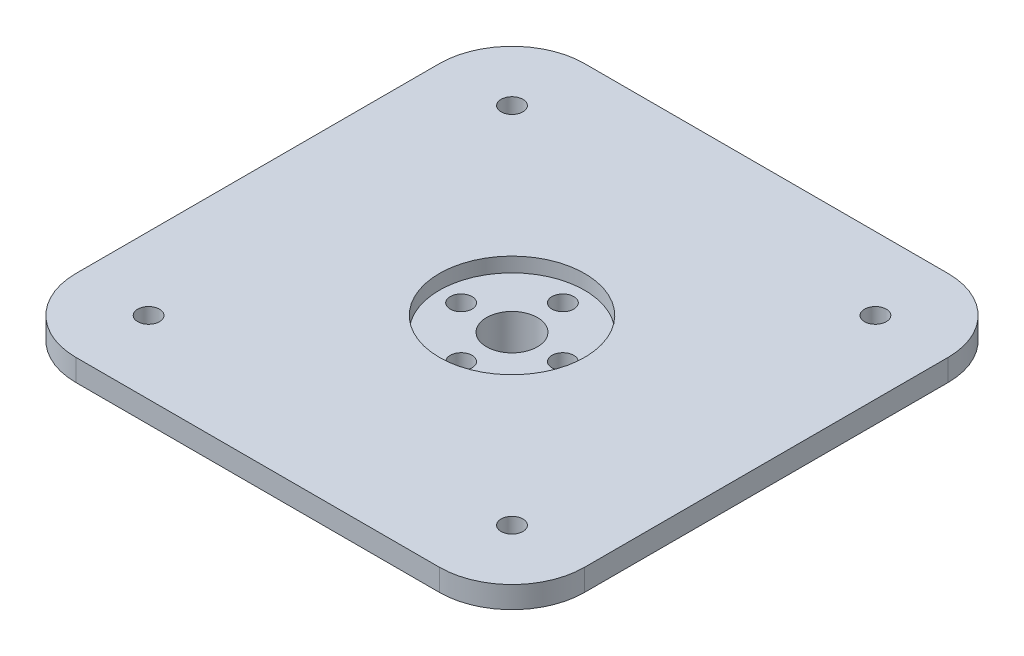
from build123d import *
from build123d.topology import SkipClean

# Parameters (mm, degrees)
SKETCH_1_R          = 1.5000000000000002
SKETCH_1_R_2        = 1.5000000000000007
SKETCH_1_R_3        = 3.5000000000000036
SKETCH_1_R_4        = 1.5000000000000004
SKETCH_1_R_5        = 1.5000000000000009
EXTRUDE_1_DEPTH     = 3
EXTRUDE_START       = 7
SKETCH_2_R          = 15.00000000000001
SKETCH_2_R_2        = 1.5000000000000002
SKETCH_2_R_3        = 3.5000000000000036
SKETCH_2_R_4        = 1.5000000000000009
SKETCH_2_R_5        = 1.5000000000000007
EXTRUDE_2_DEPTH     = 7
EXTRUDE_START_2     = 9
SKETCH_6_R          = 22
SKETCH_6_R_2        = 15
EXTRUDE_3_DEPTH     = 9
SKETCH_8_R          = 32
SKETCH_8_R_2        = 12.000000000000002
EXTRUDE_5_DEPTH     = 2
FILLET_1_R          = 10
SKETCH_11_R         = 10
CUT_EXTRUDE_1_DEPTH = 2


with BuildPart() as part:
    # 草图1 → 凸台-拉伸1 (new body)
    with BuildSketch(Plane(origin=(0, 0, 0), x_dir=(1, 0, 0), z_dir=(0, 1, 0))):
        Polygon((-35.00000000000001, -35), (34.99999999999999, -35), (34.99999999999999, 34.99999999999999), (-35.00000000000001, 35), align=None)
        with Locations(Location((4.3e-16, 6.999999999999999, 0), (0, 0, 270))):
            Circle(SKETCH_1_R, mode=Mode.SUBTRACT)
        with Locations(Location((6.999999999999999, -4.3e-16, 0), (0, 0, 270))):
            Circle(SKETCH_1_R_2, mode=Mode.SUBTRACT)
        with Locations(Location((-4.21e-15, 2.73e-15, 0), (0, 0, 270))):
            Circle(SKETCH_1_R_3, mode=Mode.SUBTRACT)
        with Locations(Location((-9.8e-16, -6.999999999999999, 0), (0, 0, 90))):
            Circle(SKETCH_1_R_4, mode=Mode.SUBTRACT)
        with Locations(Location((-6.999999999999999, 1.89e-15, 0), (0, 0, 90))):
            Circle(SKETCH_1_R_2, mode=Mode.SUBTRACT)
        with Locations(Location((25, 25, 0), (0, 0, 270))):
            Circle(SKETCH_1_R_5, mode=Mode.SUBTRACT)
        with Locations(Location((-25, 25, 0), (0, 0, 90))):
            Circle(SKETCH_1_R_5, mode=Mode.SUBTRACT)
        with Locations(Location((25, -25, 0), (0, 0, 270))):
            Circle(SKETCH_1_R_5, mode=Mode.SUBTRACT)
        with Locations(Location((-25, -25, 0), (0, 0, 90))):
            Circle(SKETCH_1_R_5, mode=Mode.SUBTRACT)
    extrude(amount=EXTRUDE_1_DEPTH)

    # 草图2 → 凸台-拉伸2 (add)
    with SkipClean():  # the faces are left unmerged after this step: merging them gives an invalid solid
        with BuildSketch(Plane.XZ.offset(EXTRUDE_START)):
            with Locations(Location((-4.21e-15, -2.73e-15, 0), (0, 0, 270))):
                Circle(SKETCH_2_R)
            with Locations(Location((-9.8e-16, 6.999999999999999, 0), (0, 0, 270))):
                Circle(SKETCH_2_R_2, mode=Mode.SUBTRACT)
            with Locations(Location((-4.21e-15, -2.73e-15, 0), (0, 0, 270))):
                Circle(SKETCH_2_R_3, mode=Mode.SUBTRACT)
            with Locations(Location((-6.999999999999999, -1.89e-15, 0), (0, 0, 270))):
                Circle(SKETCH_2_R_4, mode=Mode.SUBTRACT)
            with Locations(Location((4.3e-16, -6.999999999999999, 0), (0, 0, 270))):
                Circle(SKETCH_2_R_2, mode=Mode.SUBTRACT)
            with Locations(Location((6.999999999999999, 4.3e-16, 0), (0, 0, 270))):
                Circle(SKETCH_2_R_5, mode=Mode.SUBTRACT)
        extrude(amount=-EXTRUDE_2_DEPTH)

    # 草图6 → 凸台-拉伸3 (add)
    with SkipClean():  # the faces are left unmerged after this step: merging them gives an invalid solid
        with BuildSketch(Plane.XZ.offset(EXTRUDE_START_2)):
            with Locations(Location((0, 0, 0), (0, 0, 270))):
                Circle(SKETCH_6_R)
            with Locations(Location((0, 0, 0), (0, 0, 270))):
                Circle(SKETCH_6_R_2, mode=Mode.SUBTRACT)
        extrude(amount=-EXTRUDE_3_DEPTH)

    # 草图8 → 凸台-拉伸5 (add)
    with SkipClean():  # the faces are left unmerged after this step: merging them gives an invalid solid
        with BuildSketch(Plane.XZ):
            with Locations(Location((0, 0, 0), (0, 0, 270))):
                Circle(SKETCH_8_R)
            Circle(SKETCH_8_R_2, mode=Mode.SUBTRACT)
        extrude(amount=EXTRUDE_5_DEPTH)

    # 圆角1
    fillet_1_edges = [part.edges().sort_by_distance(p)[0] for p in [
        (34.99999999999999, 1.5, 35),
        (-35.00000000000001, 1.5, 35),
        (-35.00000000000001, 1.5, -35),
        (34.99999999999999, 1.5, -34.99999999999999),
    ]]
    fillet(fillet_1_edges, radius=FILLET_1_R)

    # 草图11 → 切除-拉伸1 (cut)
    with BuildSketch(Plane(origin=(0, 3, 0), x_dir=(1, 0, 0), z_dir=(0, 1, 0))):
        with Locations(Location((0, 0, 0), (0, 0, 270))):
            Circle(SKETCH_11_R)
    extrude(amount=-CUT_EXTRUDE_1_DEPTH, mode=Mode.SUBTRACT)


solid = part.part
